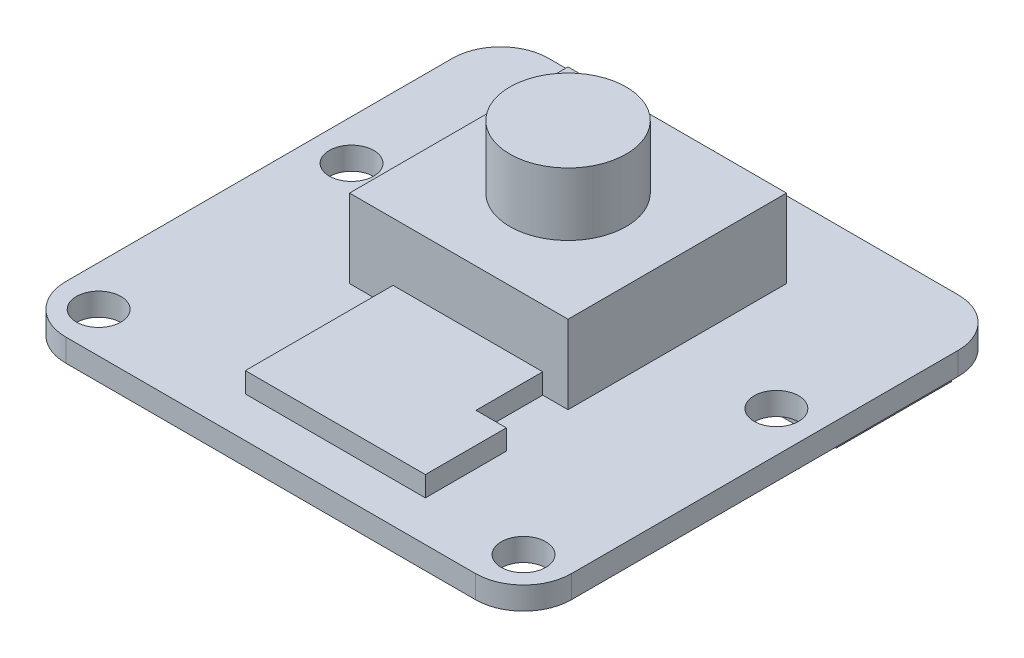
from build123d import *

# Parameters (mm, degrees)
MAINBOARD_DEPTH     = 1.12
SKETCH2_R           = 1.1
BOARDHOLES_DEPTH    = 1.12
CAMBOD_W            = 10.8
CAMBOD_H            = 10.8
CAM_BASE_DEPTH      = 3.875
CAMLENS_START       = -3.875
SKETCH4_R           = 2.875
CAMLENS_DEPTH       = 6.98
SKETCH5_W           = 19.61
SKETCH5_H           = 5.71
RIBBON_PORT_DEPTH   = 2.75
LITTLE_MODULE_DEPTH = 1


with BuildPart() as part:
    # Sketch1 → MainBoard (new body)
    with BuildSketch(Plane(origin=(0, 0, 0), x_dir=(1, 0, 0), z_dir=(0, 1, 0))):
        with BuildLine():
            Line((-10.125, 11.931), (10.125, 11.931))
            ThreePointArc((10.125, 11.931), (11.804378605, 11.235378605), (12.5, 9.556))
            Line((12.5, 9.556), (12.5, -9.556))
            ThreePointArc((12.5, -9.556), (11.804378605, -11.235378605), (10.125, -11.931))
            Line((10.125, -11.931), (-10.125, -11.931))
            ThreePointArc((-10.125, -11.931), (-11.804378605, -11.235378605), (-12.5, -9.556))
            Line((-12.5, -9.556), (-12.5, 9.556))
            ThreePointArc((-12.5, 9.556), (-11.804378605, 11.235378605), (-10.125, 11.931))
        make_face()
    extrude(amount=MAINBOARD_DEPTH)

    # Sketch2 → BoardHoles (cut)
    with BuildSketch(Plane(origin=(0, 1.12, 0), x_dir=(1, 0, 0), z_dir=(0, 1, 0))):
        with Locations(Location((-10.5, -9.931, 0), (0, 0, 270))):
            Circle(SKETCH2_R)
        with Locations(Location((-10.5, 2.569, 0), (0, 0, 270))):
            Circle(SKETCH2_R)
        with Locations(Location((10.5, -9.931, 0), (0, 0, 270))):
            Circle(SKETCH2_R)
        with Locations(Location((10.5, 2.569, 0), (0, 0, 270))):
            Circle(SKETCH2_R)
    extrude(amount=-BOARDHOLES_DEPTH, mode=Mode.SUBTRACT)

    # CamBod → Cam Base (add)
    with BuildSketch(Plane(origin=(0, 1.12, 0), x_dir=(1, 0, 0), z_dir=(0, 1, 0))):
        with Locations((0, 2.769)):
            Rectangle(CAMBOD_W, CAMBOD_H)
    extrude(amount=CAM_BASE_DEPTH)

    # Sketch4 → CamLens (add)
    with BuildSketch(Plane(origin=(0, 4.995, 0), x_dir=(1, 0, 0), z_dir=(0, 1, 0)).offset(CAMLENS_START)):
        with Locations(Location((0, 2.769, 0), (0, 0, 270))):
            Circle(SKETCH4_R)
    extrude(amount=CAMLENS_DEPTH)

    # Sketch5 → Ribbon Port (add)
    with BuildSketch(Plane.XZ):
        with Locations((0, -9.076)):
            Rectangle(SKETCH5_W, SKETCH5_H)
    extrude(amount=RIBBON_PORT_DEPTH)

    # Sketch6 → Little Module (add)
    with BuildSketch(Plane(origin=(0, 1.12, 0), x_dir=(1, 0, 0), z_dir=(0, 1, 0))):
        Polygon((-3.25, -9.931), (-3.25, -2.631), (4.15, -2.631), (4.15, -5.931), (5.65, -5.931), (5.65, -9.931), align=None)
    extrude(amount=LITTLE_MODULE_DEPTH)


solid = part.part
